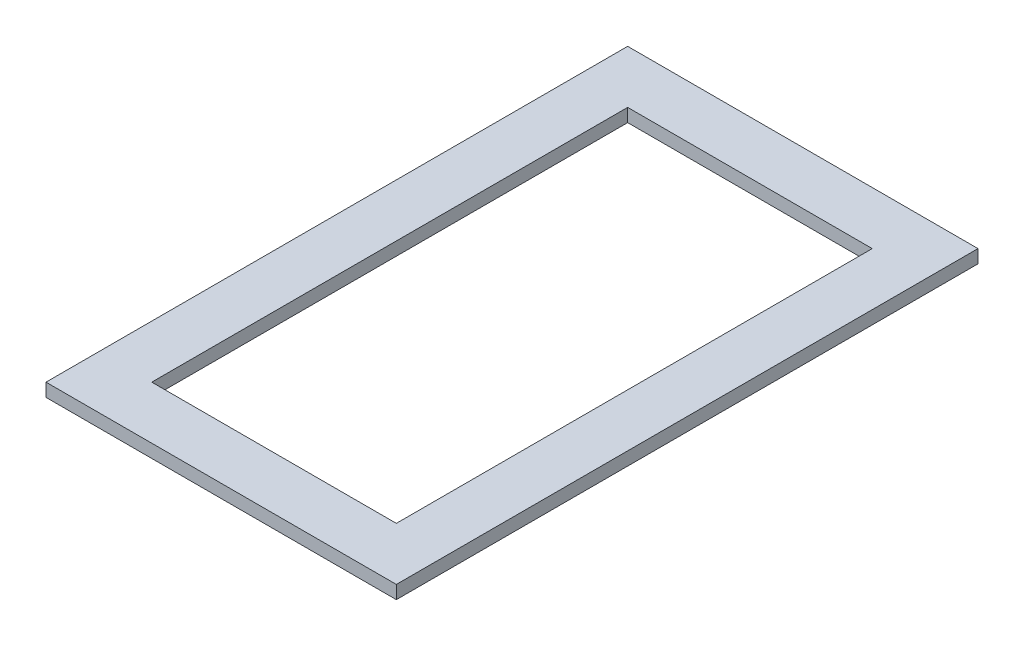
from build123d import *

# Parameters (mm, degrees)
SKETCH_1_W      = 6625
SKETCH_1_H      = 11000
SKETCH_1_W_2    = 4625
SKETCH_1_H_2    = 9000
EXTRUDE_1_DEPTH = 250


with BuildPart() as part:
    # Эскиз1 → Бобышка-Вытянуть1 (new body)
    with BuildSketch(Plane(origin=(0, 0, 0), x_dir=(1, 0, 0), z_dir=(0, 1, 0))):
        Rectangle(SKETCH_1_W, SKETCH_1_H)
        Rectangle(SKETCH_1_W_2, SKETCH_1_H_2, mode=Mode.SUBTRACT)
    extrude(amount=-EXTRUDE_1_DEPTH)


solid = part.part
